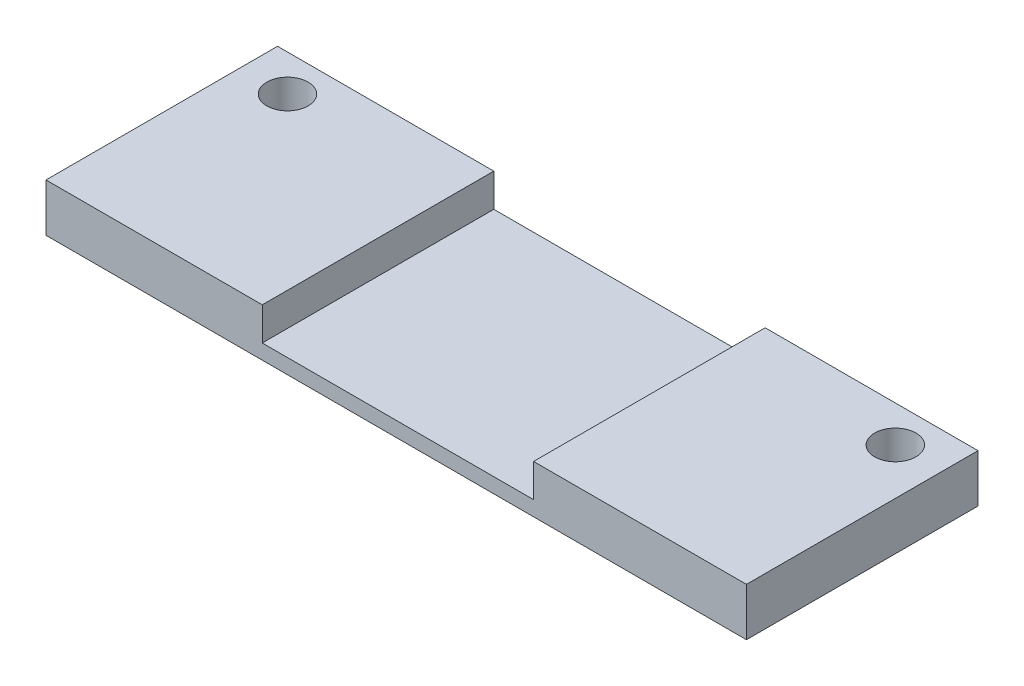
from build123d import *

# Parameters (mm, degrees)
SKETCH_1_W        = 13.075
SKETCH_1_H        = 14
SKETCH_1_R        = 1.25
EXTRUDE_2_DEPTH   = 2.9
SKETCH_1_W_2      = 12.871097853
EXTRUDE_2_2_DEPTH = 2.9
EXTRUDE_3_DEPTH   = 0.9


with BuildPart() as part:
    # 草图1 → 凸台-拉伸2 (new body)
    with BuildSketch(Plane(origin=(0, 0, 0), x_dir=(1, 0, 0), z_dir=(0, 1, 0))):
        with Locations((-7.968432469, -1.549350884)):
            Rectangle(SKETCH_1_W, SKETCH_1_H)
        with Locations((-11.705932469, 3.250649116)):
            Circle(SKETCH_1_R, mode=Mode.SUBTRACT)
    extrude(amount=EXTRUDE_2_DEPTH)



with BuildPart() as body_2:
    # 草图1 → Extrude 2 2 (new body)
    with BuildSketch(Plane(origin=(0, 0, 0), x_dir=(1, 0, 0), z_dir=(0, 1, 0))):
        with Locations((21.408518604, -1.549350884)):
            Rectangle(SKETCH_1_W_2, SKETCH_1_H)
        with Locations((25.044067531, 3.250649116)):
            Circle(SKETCH_1_R, mode=Mode.SUBTRACT)
    extrude(amount=EXTRUDE_2_2_DEPTH)


with BuildPart() as part_1:
    add(part.part)

    add(body_2.part)  # 凸台-拉伸3 merges body 2
    # 草图1<4> → 凸台-拉伸3 (add)
    with BuildSketch(Plane(origin=(0, 0, 0), x_dir=(1, 0, 0), z_dir=(0, 1, 0))):
        Polygon((14.769067531, 5.450649116), (6.669067531, 5.450649116), (-1.430932469, 5.450649116), (-1.430932469, -8.549350884), (14.972969678, -8.549350884), (14.972969678, 5.450649116), align=None)
    extrude(amount=EXTRUDE_3_DEPTH)


solid = part_1.part
